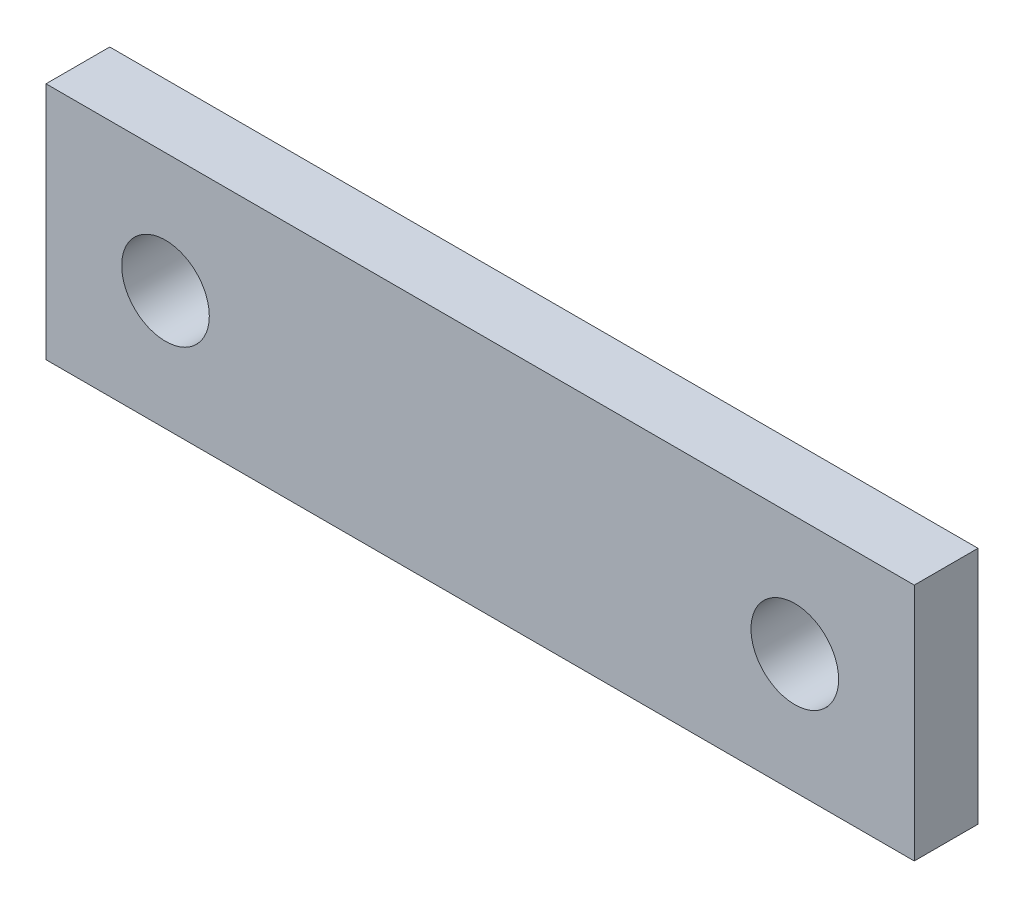
from build123d import *

# Parameters (mm, degrees)
SKETCH_1_W          = 218
SKETCH_1_H          = 60
EXTRUDE_1_DEPTH     = 16
SKETCH_2_R          = 11
CUT_EXTRUDE_2_DEPTH = 227.671568574


with BuildPart() as part:
    # 草图1 → 拉伸1 (new body)
    with BuildSketch(Plane.XY):
        with Locations((109, 30)):
            Rectangle(SKETCH_1_W, SKETCH_1_H)
    extrude(amount=EXTRUDE_1_DEPTH)

    # 草图2 → 拉伸2 (cut, through all)
    with BuildSketch(Plane.XY.offset(16)):
        with Locations((30, 30)):
            Circle(SKETCH_2_R)
        with Locations((188, 30)):
            Circle(SKETCH_2_R)
    extrude(amount=-CUT_EXTRUDE_2_DEPTH, mode=Mode.SUBTRACT)


solid = part.part
